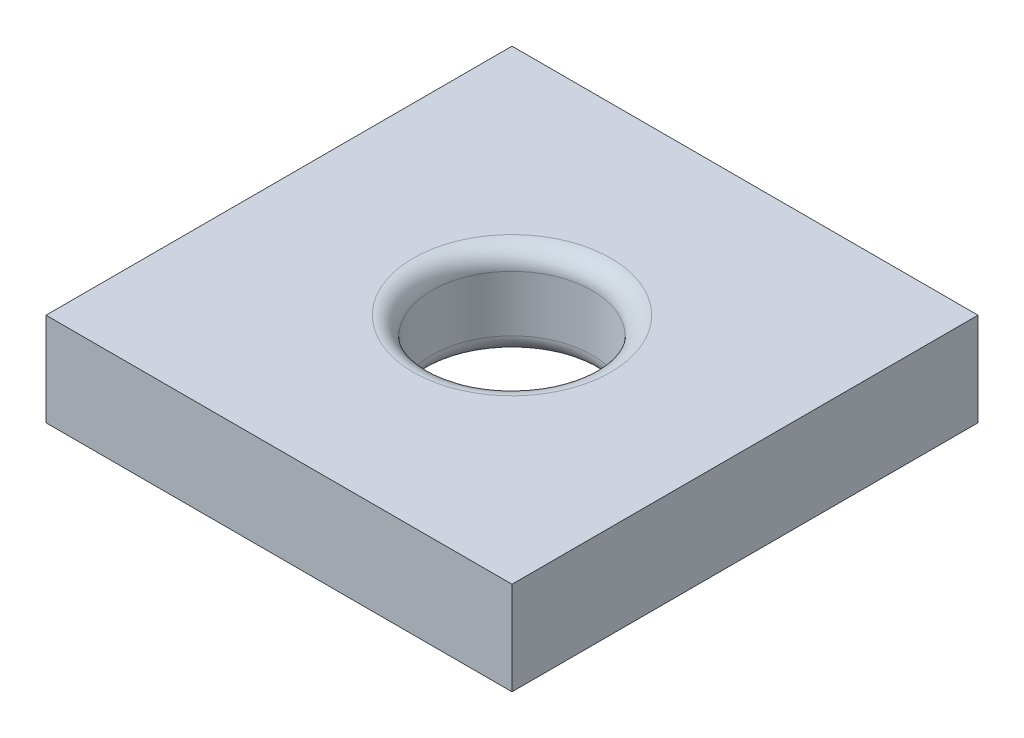
from build123d import *

# Parameters (mm, degrees)
ESQUISSE1_W             = 25
ESQUISSE1_H             = 25
BOSS_EXTRU_1_DEPTH      = 5
ENL_V_MAT_EXTRU_1_REACH = 37.707
ESQUISSE2_R             = 4.3
CONG_2_R                = 1
CONG_3_R                = 1


with BuildPart() as part:
    # Esquisse1 → Boss.-Extru.1 (new body)
    with BuildSketch(Plane(origin=(0, 0, 0), x_dir=(1, 0, 0), z_dir=(0, 1, 0))):
        with Locations((-12.5, 12.5)):
            Rectangle(ESQUISSE1_W, ESQUISSE1_H)
    extrude(amount=BOSS_EXTRU_1_DEPTH)

    # Esquisse2 → Enlèv. mat.-Extru.1 (cut, up to next)
    with BuildSketch(Plane(origin=(0, 5, 0), x_dir=(1, 0, 0), z_dir=(0, 1, 0)), mode=Mode.PRIVATE) as enl_v_mat_extru_1_sk1:
        with Locations(Location((-12.5, 12.5, 0), (0, 0, 270))):
            Circle(ESQUISSE2_R)
    enl_v_mat_extru_1_tool1 = extrude(enl_v_mat_extru_1_sk1.sketch, amount=-ENL_V_MAT_EXTRU_1_REACH, mode=Mode.PRIVATE) & part.part
    add(enl_v_mat_extru_1_tool1.solids().sort_by_distance((-12.5, 5, -12.5))[0], mode=Mode.SUBTRACT)

    # Congé2
    cong_2_edges = [part.edges().sort_by_distance(p)[0] for p in [
        (-12.5, 0, -16.8),
    ]]
    fillet(cong_2_edges, radius=CONG_2_R)

    # Congé3
    cong_3_edges = [part.edges().sort_by_distance(p)[0] for p in [
        (-12.5, 5, -16.8),
    ]]
    fillet(cong_3_edges, radius=CONG_3_R)


solid = part.part
